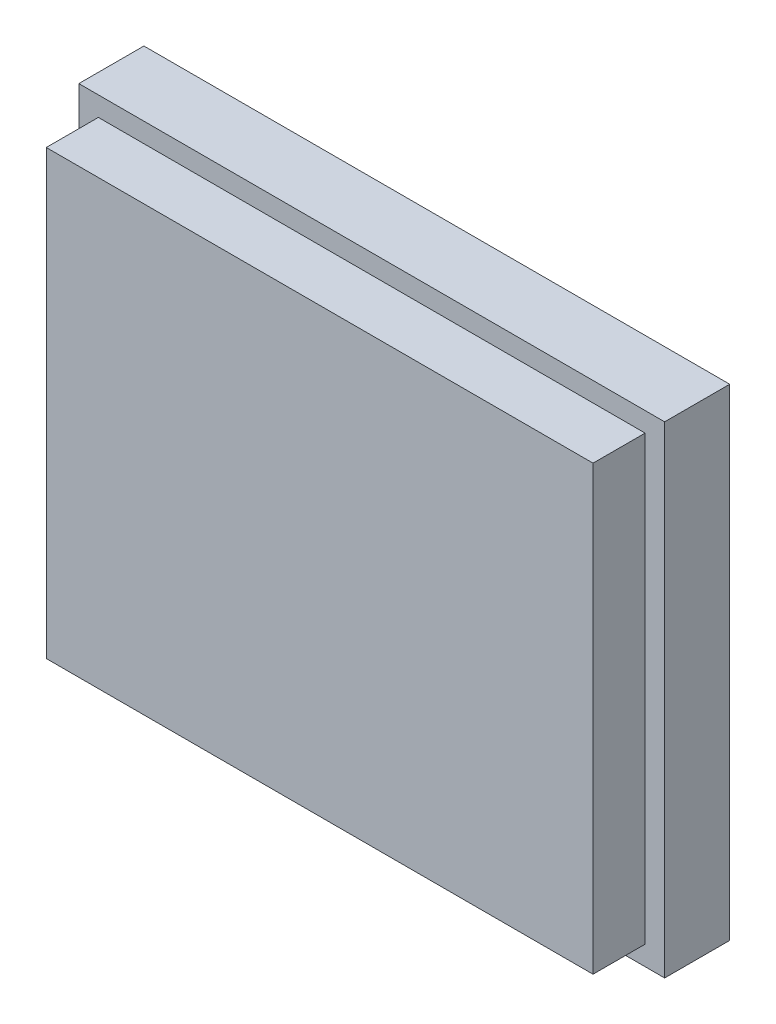
from build123d import *

# Parameters (mm, degrees)
SKETCH1_W           = 84
SKETCH1_H           = 68
BOSS_EXTRUDE1_DEPTH = 18
SKETCH1_3_W         = 90
SKETCH1_3_H         = 74
SKETCH1_3_W_2       = 84
SKETCH1_3_H_2       = 68
BOSS_EXTRUDE2_DEPTH = 10


with BuildPart() as part:
    # Sketch1 → Boss-Extrude1 (new body)
    with BuildSketch(Plane.XY):
        Rectangle(SKETCH1_W, SKETCH1_H)
    extrude(amount=BOSS_EXTRUDE1_DEPTH)

    # Sketch1<3> → Boss-Extrude2 (add)
    with BuildSketch(Plane.XY):
        Rectangle(SKETCH1_3_W, SKETCH1_3_H)
        Rectangle(SKETCH1_3_W_2, SKETCH1_3_H_2, mode=Mode.SUBTRACT)
    extrude(amount=BOSS_EXTRUDE2_DEPTH)


solid = part.part
